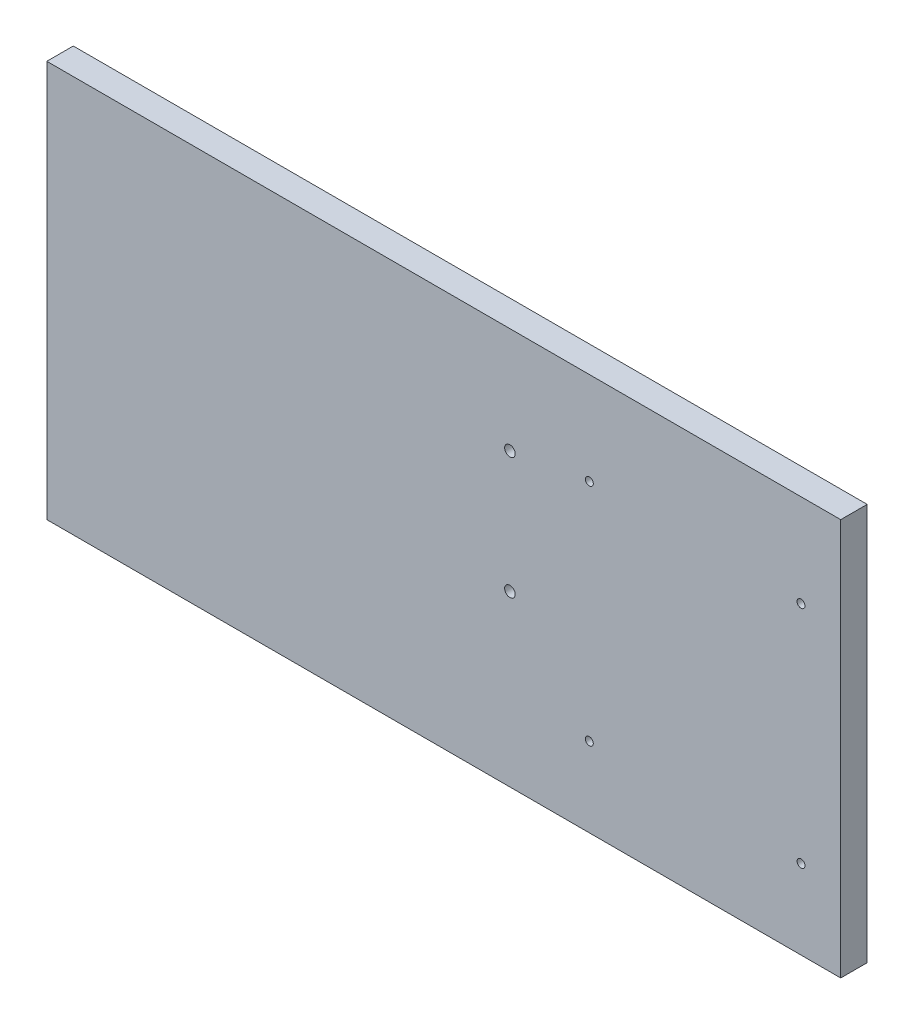
from build123d import *

# Parameters (mm, degrees)
ESBO_O1_W                = 300
ESBO_O1_H                = 150
ESBO_O1_R                = 1.5
ESBO_O1_R_2              = 2
RESSALTO_EXTRUS_O1_DEPTH = 10


with BuildPart() as part:
    # Esboço1 → Ressalto-extrusão1 (new body)
    with BuildSketch(Plane.XY):
        Rectangle(ESBO_O1_W, ESBO_O1_H)
        with Locations((135, 40)):
            Circle(ESBO_O1_R, mode=Mode.SUBTRACT)
        with Locations((135, -45)):
            Circle(ESBO_O1_R, mode=Mode.SUBTRACT)
        with Locations((55, -45)):
            Circle(ESBO_O1_R, mode=Mode.SUBTRACT)
        with Locations((55, 40)):
            Circle(ESBO_O1_R, mode=Mode.SUBTRACT)
        with Locations((25, 35)):
            Circle(ESBO_O1_R_2, mode=Mode.SUBTRACT)
        with Locations((25, -11)):
            Circle(ESBO_O1_R_2, mode=Mode.SUBTRACT)
    extrude(amount=RESSALTO_EXTRUS_O1_DEPTH)


solid = part.part
